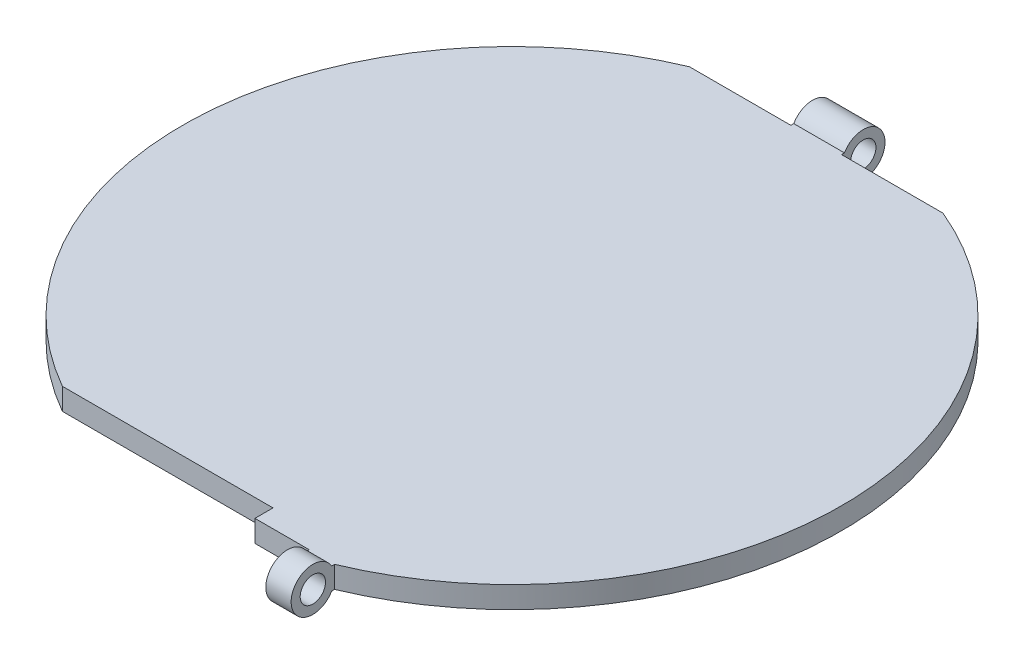
from build123d import *

# Parameters (mm, degrees)
BOSS_EXTRUDE1_DEPTH     = 3
BOSS_EXTRUDE2_START     = -10
SKETCH2_R               = 1.75
BOSS_EXTRUDE2_DEPTH     = 27.5
SKETCH3_W               = 8
SKETCH3_H               = 9
CUT_EXTRUDE1_DEPTH      = 24
SKETCH4_W               = 8
SKETCH4_H               = 9
CUT_EXTRUDE2_DEPTH      = 6.5
SKETCH5_W               = 7
SKETCH5_H               = 7
CUT_EXTRUDE3_DEPTH      = 14
CUT_EXTRUDE4_REACH      = 72.91
CUT_EXTRUDE4_END_RADIUS = 45.5
SKETCH6_W               = 11
SKETCH6_H               = 12


with BuildPart() as part:
    # Sketch1 → Boss-Extrude1 (new body)
    with BuildSketch(Plane(origin=(0, 0, 0), x_dir=(1, 0, 0), z_dir=(0, 1, 0))):
        with BuildLine():
            Line((-17.5, -42), (17.5, -42))
            ThreePointArc((17.5, -42), (45.5, 0), (17.5, 42))
            Line((17.5, 42), (-17.5, 42))
            ThreePointArc((-17.5, 42), (-45.5, 0), (-17.5, -42))
        make_face()
    extrude(amount=BOSS_EXTRUDE1_DEPTH)

    # Sketch2 → Boss-Extrude2 (add)
    with BuildSketch(Plane(origin=(0, 0, 0), x_dir=(0, 0, -1), z_dir=(1, 0, 0)).offset(BOSS_EXTRUDE2_START)):
        with BuildLine():
            Line((-42, 0), (-42.401923789, 0))
            ThreePointArc((-42.401923789, 0), (-48, 1.5), (-42.401923789, 3))
            Line((-42.401923789, 3), (-42, 3))
            Line((-42, 3), (-42, 1.5))
            Line((-42, 1.5), (-42, 0))
        make_face()
        with Locations((-45, 1.5)):
            Circle(SKETCH2_R, mode=Mode.SUBTRACT)
    boss_extrude2 = extrude(amount=BOSS_EXTRUDE2_DEPTH)

    # Mirror1: Boss-Extrude2 across plane
    add(boss_extrude2.mirror(Plane.XY))

    # Sketch3 → Cut-Extrude1 (cut)
    with BuildSketch(Plane.ZY.offset(10)):
        with Locations((46, 2)):
            Rectangle(SKETCH3_W, SKETCH3_H)
    extrude(amount=-CUT_EXTRUDE1_DEPTH, mode=Mode.SUBTRACT)

    # Sketch4 → Cut-Extrude2 (cut)
    with BuildSketch(Plane.ZY.offset(10)):
        with Locations((-46, 2)):
            Rectangle(SKETCH4_W, SKETCH4_H)
    extrude(amount=-CUT_EXTRUDE2_DEPTH, mode=Mode.SUBTRACT)

    # Sketch5 → Cut-Extrude3 (cut)
    with BuildSketch(Plane(origin=(17.5, 0, 0), x_dir=(0, 0, -1), z_dir=(1, 0, 0))):
        with Locations((45.5, 1.589580261)):
            Rectangle(SKETCH5_W, SKETCH5_H)
    extrude(amount=-CUT_EXTRUDE3_DEPTH, mode=Mode.SUBTRACT)

    # Cut-Extrude4: up to this cylinder (the profile starts inside it)
    cut_extrude4_end = Plane(origin=(0, 1.5, 0), z_dir=(0, -1, 0)) * Cylinder(CUT_EXTRUDE4_END_RADIUS, 237.82, mode=Mode.PRIVATE)
    # Sketch6 → Cut-Extrude4 (cut, up to the surface)
    with BuildSketch(Plane.ZY.offset(-6.5), mode=Mode.PRIVATE) as cut_extrude4_sk1:
        with Locations((45, 1.5)):
            Rectangle(SKETCH6_W, SKETCH6_H)
    cut_extrude4_tool1 = extrude(cut_extrude4_sk1.sketch, amount=CUT_EXTRUDE4_REACH, mode=Mode.PRIVATE) & cut_extrude4_end
    add(cut_extrude4_tool1.solids().sort_by_distance((6.5, 1.5, 45))[0], mode=Mode.SUBTRACT)


solid = part.part
